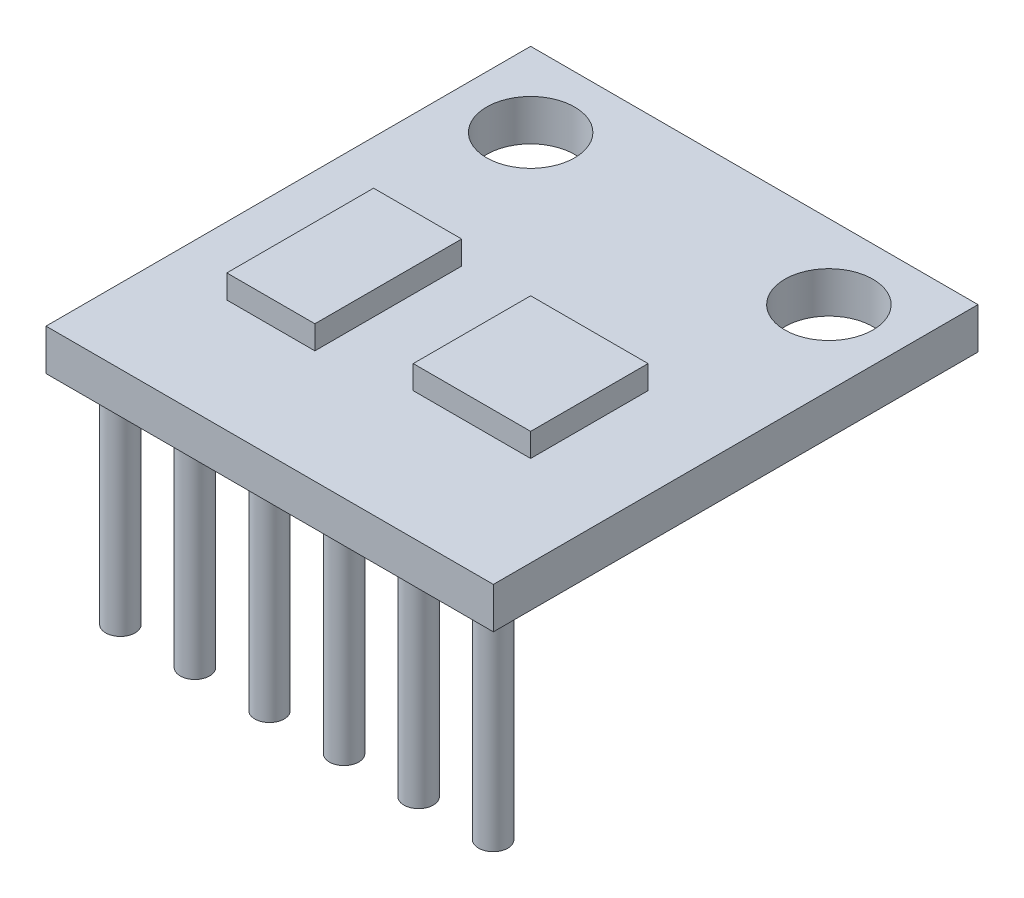
from build123d import *

# Parameters (mm, degrees)
ESQUISSE1_W        = 15.24
ESQUISSE1_H        = 16.51
ESQUISSE1_R        = 1.5
PCB_DEPTH          = 1.4
ESQUISSE2_W        = 3
ESQUISSE2_H        = 5
ADXL345_DEPTH      = 0.8
ESQUISSE3_W        = 4
ESQUISSE3_H        = 4
ITG_3200_DEPTH     = 0.8
ESQUISSE6_R        = 0.5
BOSS_EXTRU_9_DEPTH = 7.4


with BuildPart() as part:
    # Esquisse1 → PCB (new body)
    with BuildSketch(Plane(origin=(0, 0, 0), x_dir=(1, 0, 0), z_dir=(0, 1, 0))):
        with Locations((-0.009586777, 2.926831956)):
            Rectangle(ESQUISSE1_W, ESQUISSE1_H)
        with Locations(Location((-5.089586777, 8.641831956, 0), (0, 0, 270))):
            Circle(ESQUISSE1_R, mode=Mode.SUBTRACT)
        with Locations(Location((5.070413223, 8.641831956, 0), (0, 0, 270))):
            Circle(ESQUISSE1_R, mode=Mode.SUBTRACT)
    extrude(amount=PCB_DEPTH)

    # Esquisse2 → ADXL345 (add)
    with BuildSketch(Plane(origin=(0, 1.4, 0), x_dir=(1, 0, 0), z_dir=(0, 1, 0))):
        with Locations((-3.819586777, 1.021831956)):
            Rectangle(ESQUISSE2_W, ESQUISSE2_H)
    extrude(amount=ADXL345_DEPTH)

    # Esquisse3 → ITG-3200 (add)
    with BuildSketch(Plane(origin=(0, 1.4, 0), x_dir=(1, 0, 0), z_dir=(0, 1, 0))):
        with Locations((2.530413223, 1.021831956)):
            Rectangle(ESQUISSE3_W, ESQUISSE3_H)
    extrude(amount=ITG_3200_DEPTH)

    # Esquisse6 → Boss.-Extru.9 (add)
    with BuildSketch(Plane.XZ):
        with Locations(Location((-6.359586777, 4.064307622, 0), (0, 0, 90))):
            Circle(ESQUISSE6_R)
        with Locations(Location((-3.819586777, 4.064307622, 0), (0, 0, 90))):
            Circle(ESQUISSE6_R)
        with Locations(Location((-1.279586777, 4.064307622, 0), (0, 0, 90))):
            Circle(ESQUISSE6_R)
        with Locations(Location((1.260413223, 4.064307622, 0), (0, 0, 90))):
            Circle(ESQUISSE6_R)
        with Locations(Location((3.800413223, 4.064307622, 0), (0, 0, 90))):
            Circle(ESQUISSE6_R)
        with Locations(Location((6.340413223, 4.064307622, 0), (0, 0, 90))):
            Circle(ESQUISSE6_R)
    extrude(amount=BOSS_EXTRU_9_DEPTH)


solid = part.part
